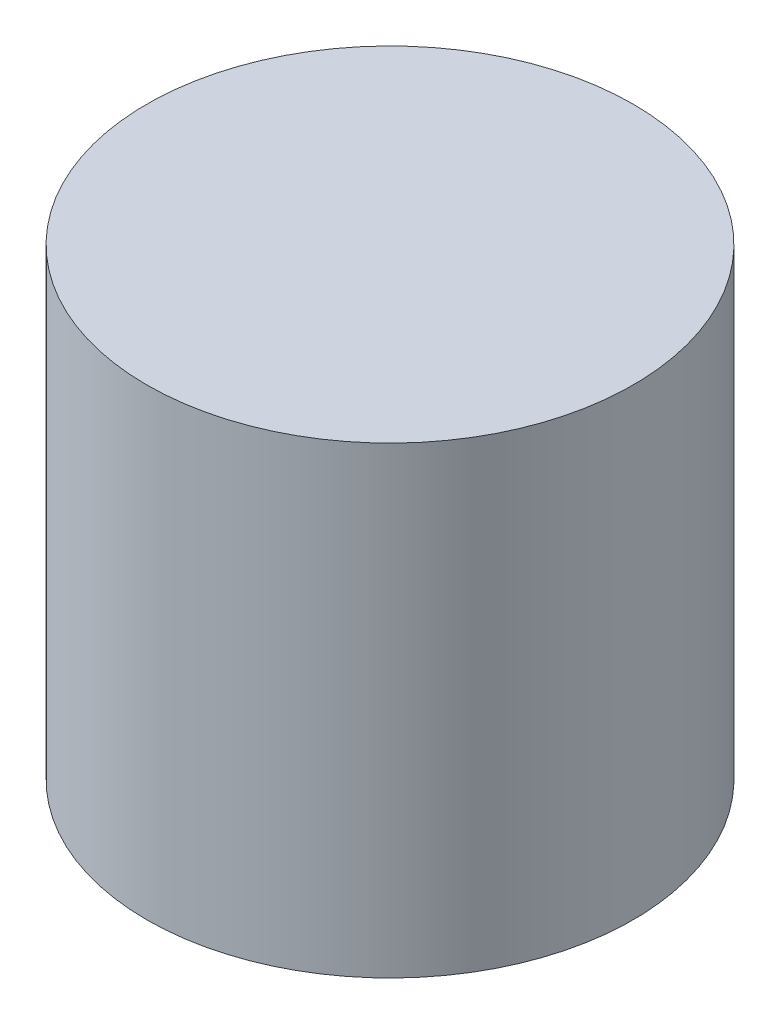
from build123d import *

# Parameters (mm, degrees)
CROQUIS1_R              = 10.5
SALIENTE_EXTRUIR1_DEPTH = 20


with BuildPart() as part:
    # Croquis1 → Saliente-Extruir1 (new body)
    with BuildSketch(Plane(origin=(0, 0, 0), x_dir=(1, 0, 0), z_dir=(0, 1, 0))):
        with Locations(Location((0, 0, 0), (0, 0, 270))):
            Circle(CROQUIS1_R)
    extrude(amount=SALIENTE_EXTRUIR1_DEPTH)


solid = part.part
